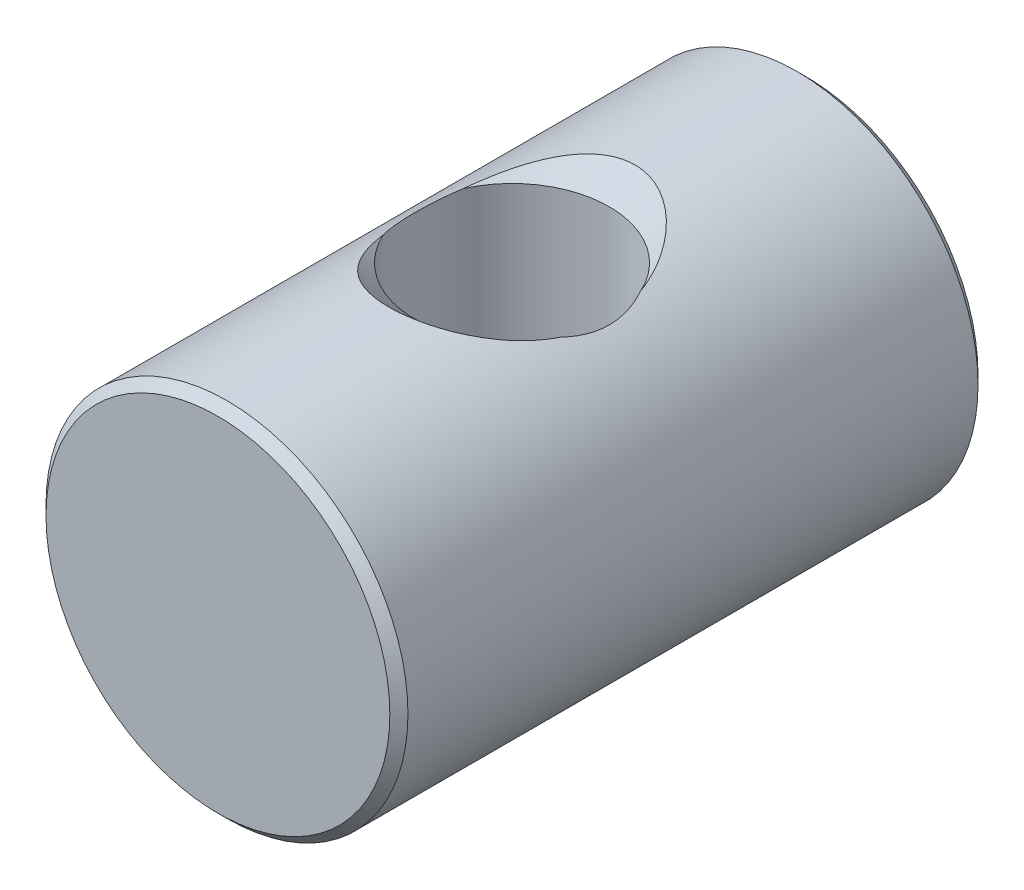
from build123d import *

# Parameters (mm, degrees)
CROQUIS1_W                 = 4
CROQUIS1_H                 = 13
CHAFL_N1_SIZE              = 0.2
CORTAR_EXTRUIR1_DEPTH      = 9.61684397
CORTAR_EXTRUIR1_DEPTH_BACK = 9.61684397
CROQUIS2_R                 = 2.15


with BuildPart() as part:
    # Croquis1 → Revolución1 (revolve)
    with BuildSketch(Plane(origin=(0, 0, 0), x_dir=(1, 0, 0), z_dir=(0, 1, 0)), mode=Mode.PRIVATE) as revoluci_n1_sk:
        with Locations((2, 0)):
            Rectangle(CROQUIS1_W, CROQUIS1_H)
    revolve(revoluci_n1_sk.sketch.rotate(Axis((0, 0, -6.5), (0, 0, 1)), 180), axis=Axis((0, 0, -6.5), (0, 0, 1)))

    # Chaflán1
    chafl_n1_edges = [part.edges().sort_by_distance(p)[0] for p in [
        (4, 0, 6.5),
        (4, 0, -6.5),
    ]]
    chamfer(chafl_n1_edges, length=CHAFL_N1_SIZE)

    # Croquis2 → Cortar-Extruir1 (cut, two sides: drawn at the far end of the back side and taken through both)
    with BuildSketch(Plane(origin=(0, 0, 0), x_dir=(1, 0, 0), z_dir=(0, 1, 0)).offset(-CORTAR_EXTRUIR1_DEPTH_BACK)):
        with Locations(Location((0, 0, 0), (0, 0, 270))):
            Circle(CROQUIS2_R)
    extrude(amount=CORTAR_EXTRUIR1_DEPTH + CORTAR_EXTRUIR1_DEPTH_BACK, mode=Mode.SUBTRACT)

    # Croquis3 → Cortar-Revolución1 (revolve, cut)
    with BuildSketch(Plane(origin=(0, 0, 0), x_dir=(0, 0, -1), z_dir=(1, 0, 0))):
        Polygon((0, 2.827658977), (-1.417641815, 2.827658977), (-3.618319017, 4.807613665), (0, 4.807613665), align=None)
    cortar_revoluci_n1 = revolve(axis=Axis((0, 0, 0), (0, 1, 0)), mode=Mode.SUBTRACT)

    # Simetría1: Cortar-Revolución1 across plane
    add(cortar_revoluci_n1.mirror(Plane.ZX), mode=Mode.SUBTRACT)


solid = part.part
